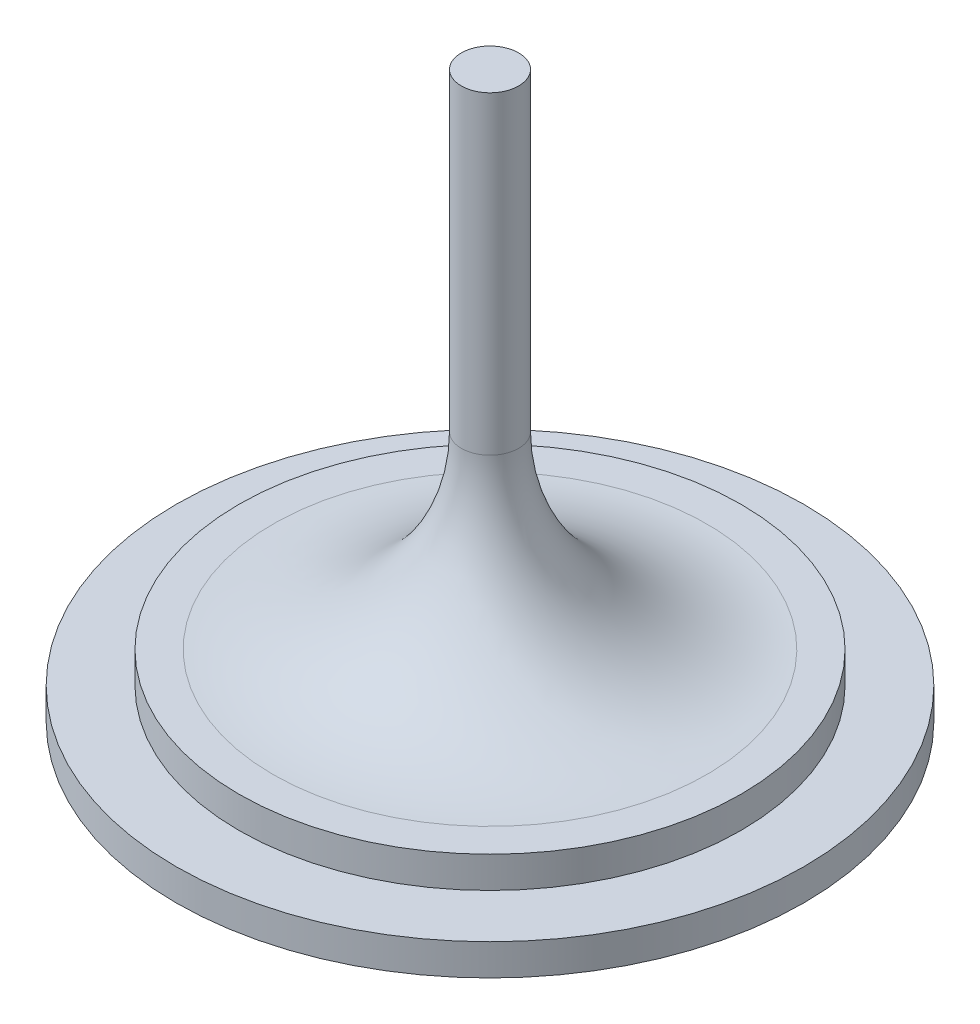
from build123d import *


with BuildPart() as part:
    # Sketch1 → Revolve1 (revolve)
    with BuildSketch(Plane.XY, mode=Mode.PRIVATE) as revolve1_sk:
        with BuildLine():
            Line((0, 0), (31.75, 0))
            Line((31.75, 0), (31.75, 3.175))
            Line((31.75, 3.175), (25.4, 3.175))
            Line((25.4, 3.175), (25.4, 6.35))
            Line((25.4, 6.35), (21.95, 6.35))
            ThreePointArc((21.95, 6.35), (8.479615818, 11.929615818), (2.9, 25.4))
            Line((2.9, 25.4), (2.9, 57.15))
            Line((2.9, 57.15), (0, 57.15))
            Line((0, 57.15), (0, 0))
        make_face()
    revolve(revolve1_sk.sketch.rotate(Axis((0, 0, 0), (0, -1, 0)), 90), axis=Axis((0, 0, 0), (0, -1, 0)))


solid = part.part
